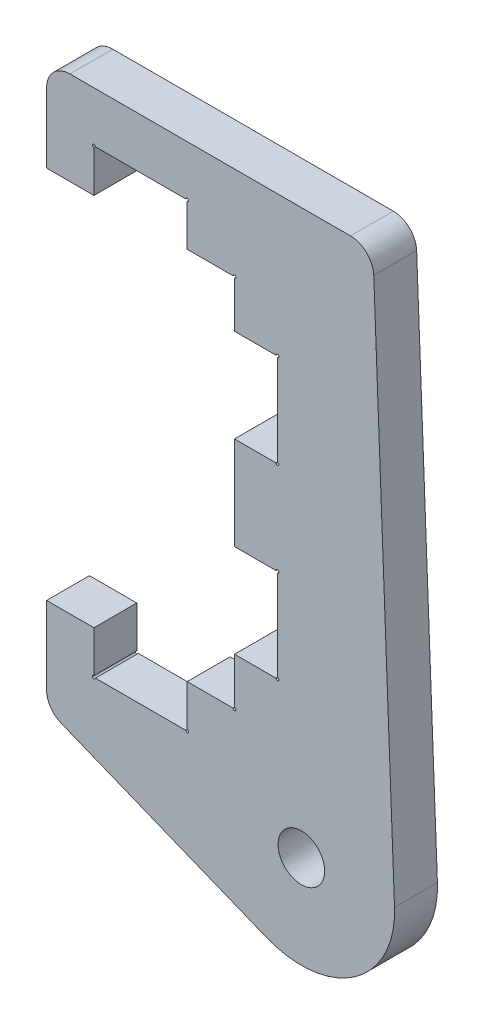
from build123d import *

# Parameters (mm, degrees)
SKETCH1_R           = 3.175
BOSS_EXTRUDE1_DEPTH = 5.842
FILLET2_R           = 3.175
SKETCH2_R           = 0.1984375
CUT_EXTRUDE1_DEPTH  = 63.076766734


with BuildPart() as part:
    # Sketch1 → Boss-Extrude1 (new body)
    with BuildSketch(Plane.XY):
        with BuildLine():
            Line((-12.8, -25.5), (-6.35, -25.5))
            Line((-6.35, -25.5), (-6.35, -31.342))
            Line((-6.35, -31.342), (6.35, -31.342))
            Line((6.35, -31.342), (6.35, -25.5))
            Line((6.35, -25.5), (12.8, -25.5))
            Line((12.8, -25.5), (12.8, -19.05))
            Line((12.8, -19.05), (18.642, -19.05))
            Line((18.642, -19.05), (18.642, -6.35))
            Line((18.642, -6.35), (12.8, -6.35))
            Line((12.8, -6.35), (12.8, 6.35))
            Line((12.8, 6.35), (18.642, 6.35))
            Line((18.642, 6.35), (18.642, 19.05))
            Line((18.642, 19.05), (12.8, 19.05))
            Line((12.8, 19.05), (12.8, 25.5))
            Line((12.8, 25.5), (6.35, 25.5))
            Line((6.35, 25.5), (6.35, 31.342))
            Line((6.35, 31.342), (-6.35, 31.342))
            Line((-6.35, 31.342), (-6.35, 25.5))
            Line((-6.35, 25.5), (-12.8, 25.5))
            Line((-12.8, 25.5), (-12.8, 38.2))
            Line((-12.8, 38.2), (31.65, 38.2))
            Line((31.65, 38.2), (34.596048217, -38.0134839))
            ThreePointArc((34.596048217, -38.0134839), (29.212391738, -48.89151732), (17.154957424, -50.282073297))
            Line((17.154957424, -50.282073297), (-12.8, -38.2))
            Line((-12.8, -38.2), (-12.8, -25.5))
        make_face()
        with Locations((21.905525927, -38.504038703)):
            Circle(SKETCH1_R, mode=Mode.SUBTRACT)
    extrude(amount=BOSS_EXTRUDE1_DEPTH)

    # Fillet2
    fillet2_edges = [part.edges().sort_by_distance(p)[0] for p in [
        (-12.8, 38.2, 2.921),
        (31.65, 38.2, 2.921),
        (-12.8, -38.2, 2.921),
    ]]
    fillet(fillet2_edges, radius=FILLET2_R)

    # Sketch2 → Cut-Extrude1 (cut, through all)
    with BuildSketch(Plane.XY.offset(5.842)):
        with Locations((-6.35, 31.342)):
            Circle(SKETCH2_R)
        with Locations((6.35, 31.342)):
            Circle(SKETCH2_R)
        with Locations((12.8, 25.5)):
            Circle(SKETCH2_R)
        with Locations((18.642, 6.35)):
            Circle(SKETCH2_R)
        with Locations((18.642, 19.05)):
            Circle(SKETCH2_R)
        with Locations((18.642, -19.05)):
            Circle(SKETCH2_R)
        with Locations((18.642, -6.35)):
            Circle(SKETCH2_R)
        with Locations((12.8, -25.5)):
            Circle(SKETCH2_R)
        with Locations((6.35, -31.342)):
            Circle(SKETCH2_R)
        with Locations((-6.35, -31.342)):
            Circle(SKETCH2_R)
    extrude(amount=-CUT_EXTRUDE1_DEPTH, mode=Mode.SUBTRACT)


solid = part.part
